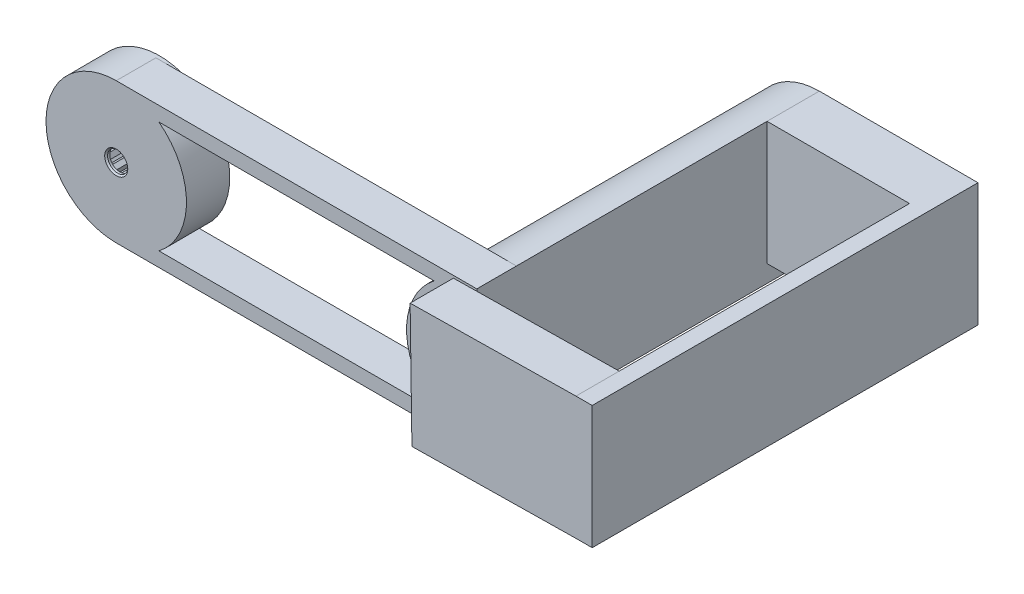
from build123d import *

# Parameters (mm, degrees)
ESQUISSE1_R        = 9.739786638
BOSS_EXTRU_1_DEPTH = 5.5
ESQUISSE2_R        = 9.739786638
ESQUISSE2_R_2      = 1.4
BOSS_EXTRU_2_DEPTH = 0.5
CHANFREIN1_SIZE    = 0.2
BOSS_EXTRU_3_START = -5.5
BOSS_EXTRU_3_DEPTH = 5.5
BOSS_EXTRU_4_START = 42
BOSS_EXTRU_4_DEPTH = 42
BOSS_EXTRU_5_DEPTH = 22
BOSS_EXTRU_6_DEPTH = 46.25
ESQUISSE7_W        = 6
ESQUISSE7_H        = 17.089185867
BOSS_EXTRU_7_DEPTH = 23


with BuildPart() as part:
    # Esquisse1 → Boss.-Extru.1 (new body)
    with BuildSketch(Plane.XY):
        with Locations((-10.25, -10)):
            Circle(ESQUISSE1_R)
        with BuildLine():
            Line((-5.751675839, -9.877200395), (-6.833750507, -9.782531128))
            Line((-6.833750507, -9.782531128), (-6.949445107, -9.126394451))
            Line((-6.949445107, -9.126394451), (-5.953521963, -8.661987862))
            ThreePointArc((-5.953521963, -8.661987862), (-6.006634107, -8.502052772), (-6.065697468, -8.344218516))
            Line((-6.065697468, -8.344218516), (-7.138261768, -8.631611254))
            Line((-7.138261768, -8.631611254), (-7.47139109, -8.054614344))
            Line((-7.47139109, -8.054614344), (-6.678798898, -7.262022153))
            ThreePointArc((-6.678798898, -7.262022153), (-6.782621037, -7.131675902), (-6.891198054, -7.005263035))
            Line((-6.891198054, -7.005263035), (-7.818046533, -7.654249327))
            Line((-7.818046533, -7.654249327), (-8.328430264, -7.225986526))
            Line((-8.328430264, -7.225986526), (-7.847635402, -6.194918616))
            ThreePointArc((-7.847635402, -6.194918616), (-7.988951343, -6.109285545), (-8.133315872, -6.028898352))
            Line((-8.133315872, -6.028898352), (-8.791112727, -6.968329619))
            Line((-8.791112727, -6.968329619), (-9.417191057, -6.740455742))
            Line((-9.417191057, -6.740455742), (-9.317216173, -5.597737589))
            ThreePointArc((-9.317216173, -5.597737589), (-9.478728542, -5.566588183), (-9.641271425, -5.541362369))
            Line((-9.641271425, -5.541362369), (-9.940094206, -6.656584169))
            Line((-9.940094206, -6.656584169), (-10.606352849, -6.656584169))
            Line((-10.606352849, -6.656584169), (-10.903477232, -5.547700874))
            ThreePointArc((-10.903477232, -5.547700874), (-11.065761738, -5.574558464), (-11.226956242, -5.607329229))
            Line((-11.226956242, -5.607329229), (-11.126406846, -6.756614081))
            Line((-11.126406846, -6.756614081), (-11.752485176, -6.984487958))
            Line((-11.752485176, -6.984487958), (-12.406540122, -6.050400691))
            ThreePointArc((-12.406540122, -6.050400691), (-12.550096477, -6.132241451), (-12.690551241, -6.219297732))
            Line((-12.690551241, -6.219297732), (-12.206963835, -7.256354271))
            Line((-12.206963835, -7.256354271), (-12.717347566, -7.684617071))
            Line((-12.717347566, -7.684617071), (-13.638885709, -7.039349117))
            ThreePointArc((-13.638885709, -7.039349117), (-13.74618945, -7.166864047), (-13.848697947, -7.298264801))
            Line((-13.848697947, -7.298264801), (-13.051434053, -8.095528695))
            Line((-13.051434053, -8.095528695), (-13.384563375, -8.672525605))
            Line((-13.384563375, -8.672525605), (-14.450903238, -8.3868007))
            ThreePointArc((-14.450903238, -8.3868007), (-14.508366703, -8.545244687), (-14.559856563, -8.705729393))
            Line((-14.559856563, -8.705729393), (-13.557961929, -9.172920534))
            Line((-13.557961929, -9.172920534), (-13.673656528, -9.829057211))
            Line((-13.673656528, -9.829057211), (-14.74934404, -9.923167674))
            ThreePointArc((-14.74934404, -9.923167674), (-14.749021481, -10.093838761), (-14.74222728, -10.264374865))
            Line((-14.74222728, -10.264374865), (-13.665452724, -10.358580432))
            Line((-13.665452724, -10.358580432), (-13.549758125, -11.014717109))
            Line((-13.549758125, -11.014717109), (-14.506309194, -11.460764198))
            ThreePointArc((-14.506309194, -11.460764198), (-14.447094307, -11.623083293), (-14.381691786, -11.78300953))
            Line((-14.381691786, -11.78300953), (-13.360941463, -11.509500306))
            Line((-13.360941463, -11.509500306), (-13.027812142, -12.086497216))
            Line((-13.027812142, -12.086497216), (-13.758807936, -12.817493011))
            ThreePointArc((-13.758807936, -12.817493011), (-13.646852578, -12.951506829), (-13.529782028, -13.081076086))
            Line((-13.529782028, -13.081076086), (-12.681156698, -12.486862233))
            Line((-12.681156698, -12.486862233), (-12.170772967, -12.915125033))
            Line((-12.170772967, -12.915125033), (-12.600738895, -13.837189942))
            ThreePointArc((-12.600738895, -13.837189942), (-12.448909121, -13.926168447), (-12.293716433, -14.009142444))
            Line((-12.293716433, -14.009142444), (-11.708090504, -13.172781941))
            Line((-11.708090504, -13.172781941), (-11.082012174, -13.400655818))
            Line((-11.082012174, -13.400655818), (-11.169878896, -14.404977051))
            ThreePointArc((-11.169878896, -14.404977051), (-10.996236031, -14.437694422), (-10.821442589, -14.463569577))
            Line((-10.821442589, -14.463569577), (-10.559109026, -13.48452739))
            Line((-10.559109026, -13.48452739), (-9.892850383, -13.48452739))
            Line((-9.892850383, -13.48452739), (-9.632173683, -14.457386077))
            ThreePointArc((-9.632173683, -14.457386077), (-9.45766281, -14.42969545), (-9.284373537, -14.395175256))
            Line((-9.284373537, -14.395175256), (-9.372796385, -13.384497479))
            Line((-9.372796385, -13.384497479), (-8.746718055, -13.156623602))
            Line((-8.746718055, -13.156623602), (-8.164782025, -13.987714383))
            ThreePointArc((-8.164782025, -13.987714383), (-8.010469052, -13.903139907), (-7.859580663, -13.812596936))
            Line((-7.859580663, -13.812596936), (-8.292239396, -12.884757289))
            Line((-8.292239396, -12.884757289), (-7.781855665, -12.456494489))
            Line((-7.781855665, -12.456494489), (-6.938532496, -13.046995729))
            ThreePointArc((-6.938532496, -13.046995729), (-6.822819391, -12.916236114), (-6.712266113, -12.78108593))
            Line((-6.712266113, -12.78108593), (-7.447769178, -12.045582865))
            Line((-7.447769178, -12.045582865), (-7.114639857, -11.468585954))
            Line((-7.114639857, -11.468585954), (-6.100183444, -11.740408731))
            ThreePointArc((-6.100183444, -11.740408731), (-6.036436962, -11.579837499), (-5.978900904, -11.416937723))
            Line((-5.978900904, -11.416937723), (-6.941241303, -10.968191026))
            Line((-6.941241303, -10.968191026), (-6.825546704, -10.312054348))
            Line((-6.825546704, -10.312054348), (-5.755303948, -10.21842024))
            ThreePointArc((-5.755303948, -10.21842024), (-5.750254354, -10.04784472), (-5.751675839, -9.877200395))
        make_face(mode=Mode.SUBTRACT)
    extrude(amount=BOSS_EXTRU_1_DEPTH)

    # Esquisse2 → Boss.-Extru.2 (add)
    with BuildSketch(Plane.XY.offset(5.5)):
        with Locations((-10.25, -10)):
            Circle(ESQUISSE2_R)
        with Locations((-10.249601616, -10.07055578)):
            Circle(ESQUISSE2_R_2, mode=Mode.SUBTRACT)
    extrude(amount=BOSS_EXTRU_2_DEPTH)

    # Chanfrein1
    chanfrein1_edges = [part.edges().sort_by_distance(p)[0] for p in [
        (-11.649601616, -10.07055578, 6),
    ]]
    chamfer(chanfrein1_edges, length=CHANFREIN1_SIZE)

    # Esquisse3 → Boss.-Extru.3 (add)
    with BuildSketch(Plane.XY.offset(6).offset(BOSS_EXTRU_3_START)):
        with BuildLine():
            Line((-10.25, -0.260213362), (39.75, -0.260213362))
            Line((39.75, -0.260213362), (39.75, -19.739786638))
            Line((39.75, -19.739786638), (-10.25, -19.739786638))
            ThreePointArc((-10.25, -19.739786638), (-19.989786638, -10), (-10.25, -0.260213362))
        make_face()
        with BuildLine():
            Line((33.837373972, -17.739786638), (-10.25, -17.739786638))
            ThreePointArc((-10.25, -17.739786638), (-17.989786638, -10), (-10.25, -2.260213362))
            Line((-10.25, -2.260213362), (33.837373972, -2.260213362))
            ThreePointArc((33.837373972, -2.260213362), (30.010213362, -10), (33.837373972, -17.739786638))
        make_face(mode=Mode.SUBTRACT)
    extrude(amount=BOSS_EXTRU_3_DEPTH)

    # Esquisse4 → Boss.-Extru.4 (add)
    with BuildSketch(Plane(origin=(0, 0, 0.5), x_dir=(-1, 0, 0), z_dir=(0, 0, -1)).offset(BOSS_EXTRU_4_START)):
        with BuildLine():
            Line((-39.75, -0.260213362), (-39.75, -19.739786638))
            ThreePointArc((-39.75, -19.739786638), (-30.010213362, -10), (-39.75, -0.260213362))
        make_face()
    extrude(amount=-BOSS_EXTRU_4_DEPTH)

    # Esquisse5 → Boss.-Extru.5 (add)
    with BuildSketch(Plane(origin=(39.75, 0, 0), x_dir=(0, 0, -1), z_dir=(1, 0, 0))):
        Polygon((34.25, -0.260213362), (34.25, -17.347570489), (39.5, -17.347570489), (41.5, -17.347570489), (41.5, -0.260213362), align=None)
    extrude(amount=BOSS_EXTRU_5_DEPTH)

    # Esquisse6 → Boss.-Extru.6 (add)
    with BuildSketch(Plane.XY.offset(-34.25)):
        Polygon((61.75, -0.260213362), (59.5, -0.260213362), (59.75, -17.347570489), (61.75, -17.347570489), align=None)
    extrude(amount=BOSS_EXTRU_6_DEPTH)

    # Esquisse7 → Boss.-Extru.7 (add)
    with BuildSketch(Plane(origin=(59.483460022, 0.870284673, 0), x_dir=(0, 0, 1), z_dir=(-0.9998929884849062, -0.014629134585590956, 0))):
        with Locations((9, -9.675211958)):
            Rectangle(ESQUISSE7_W, ESQUISSE7_H)
    extrude(amount=BOSS_EXTRU_7_DEPTH)


solid = part.part
